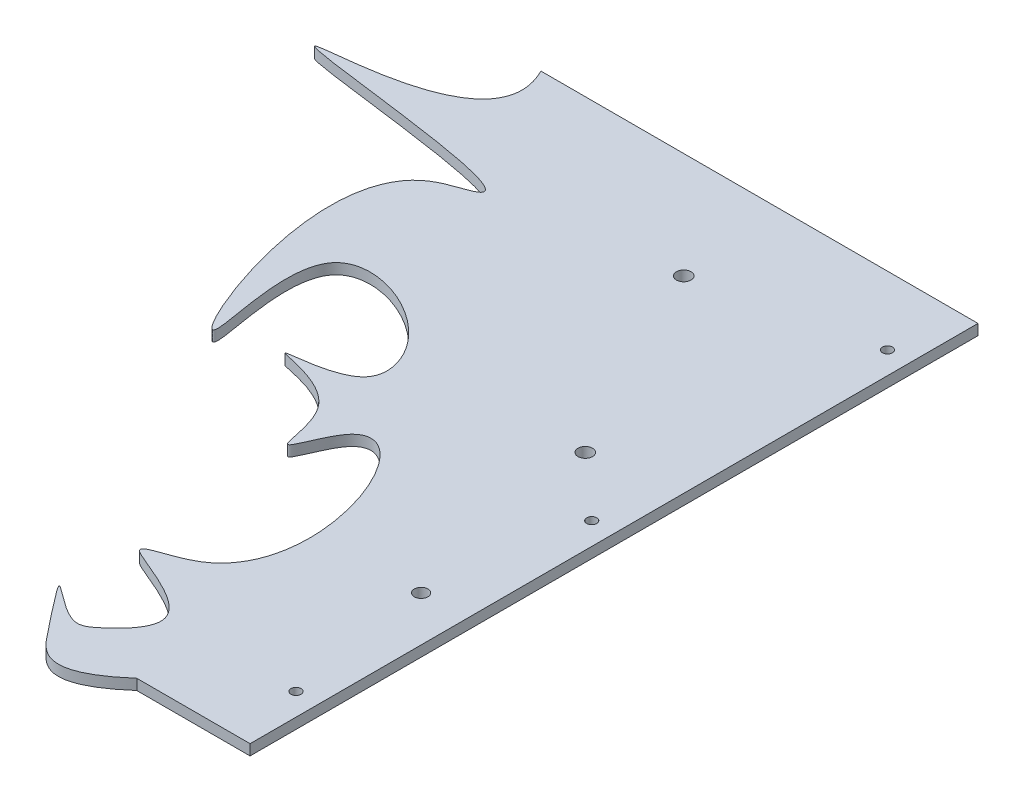
from build123d import *

# Parameters (mm, degrees)
SKETCH1_R           = 1.397
SKETCH1_R_2         = 1.905
SKETCH1_R_3         = 2.032
BOSS_EXTRUDE1_DEPTH = 2.9718
BOSS_EXTRUDE2_DEPTH = 2.9718
SKETCH3_W           = 19.169080815
SKETCH3_H           = 203.2
CUT_EXTRUDE1_DEPTH  = 2.9718


with BuildPart() as part:
    # Sketch1 → Boss-Extrude1 (new body)
    with BuildSketch(Plane(origin=(0, 0, 0), x_dir=(1, 0, 0), z_dir=(0, 1, 0))):
        Polygon((50.8, 203.2), (-90.3859, 203.2), (0, 112.8141), (0, 0), (50.8, 0), align=None)
        with Locations(Location((25.4, 19.05, 0), (0, 0, 270))):
            Circle(SKETCH1_R, mode=Mode.SUBTRACT)
        with Locations(Location((19.05, 60.325, 0), (0, 0, 270))):
            Circle(SKETCH1_R_2, mode=Mode.SUBTRACT)
        with Locations(Location((25.4, 101.6, 0), (0, 0, 270))):
            Circle(SKETCH1_R, mode=Mode.SUBTRACT)
        with Locations(Location((8.001926693, 117.195820473, 0), (0, 0, 270))):
            Circle(SKETCH1_R_3, mode=Mode.SUBTRACT)
        with Locations(Location((25.4, 184.15, 0), (0, 0, 270))):
            Circle(SKETCH1_R, mode=Mode.SUBTRACT)
        with Locations(Location((-20.92288338, 173.612500153, 0), (0, 0, 270))):
            Circle(SKETCH1_R_3, mode=Mode.SUBTRACT)
    extrude(amount=BOSS_EXTRUDE1_DEPTH)

    # Sketch2 → Boss-Extrude2 (add)
    with BuildSketch(Plane(origin=(0, 2.9718, 0), x_dir=(1, 0, 0), z_dir=(0, 1, 0))):
        with BuildLine():
            add(Edge.make_bspline(
                [(0, 0), (-14.464594888, -12.695689828), (-45.366235275, 26.014935883), (-25.291424209, 1.790307492), (-15.744380964, 7.807428898), (-4.361149162, 20.216418658), (-20.92568504, 26.898478787), (-34.390684058, 32.605210449), (7.675188284, 37.872238078), (-23.374614408, 114.697788396), (-36.704173586, 69.893607548), (-36.131542501, 97.549503069), (-70.641711547, 99.50055604), (-37.855296611, 100.496777307), (-40.75649841, 124.838600149), (-85.430765313, 143.187597425), (-60.950995266, 57.65195858), (-103.823887762, 156.563665876), (-47.630891302, 169.647448316), (-186.570491631, 180.236051465), (-78.005320962, 178.491952171), (-90.3859, 203.2)],
                knots=[0, 0, 0, 0, 0.007217683, 0.045329842, 0.054764262, 0.083217198, 0.130285386, 0.137597353, 0.165212972, 0.280552441, 0.307038367, 0.33845676, 0.381582262, 0.421093035, 0.443121969, 0.520121141, 0.590944265, 0.735519102, 0.757642294, 0.887962506, 1, 1, 1, 1], degree=3))
            Line((0, 0), (0, 112.8141))
            Line((0, 112.8141), (-90.3859, 203.2))
        make_face()
    extrude(amount=-BOSS_EXTRUDE2_DEPTH)

    # Sketch3 → Cut-Extrude1 (cut)
    with BuildSketch(Plane(origin=(0, 2.9718, 0), x_dir=(1, 0, 0), z_dir=(0, 1, 0))):
        with Locations((41.215459593, 101.6)):
            Rectangle(SKETCH3_W, SKETCH3_H)
    extrude(amount=-CUT_EXTRUDE1_DEPTH, mode=Mode.SUBTRACT)


solid = part.part
